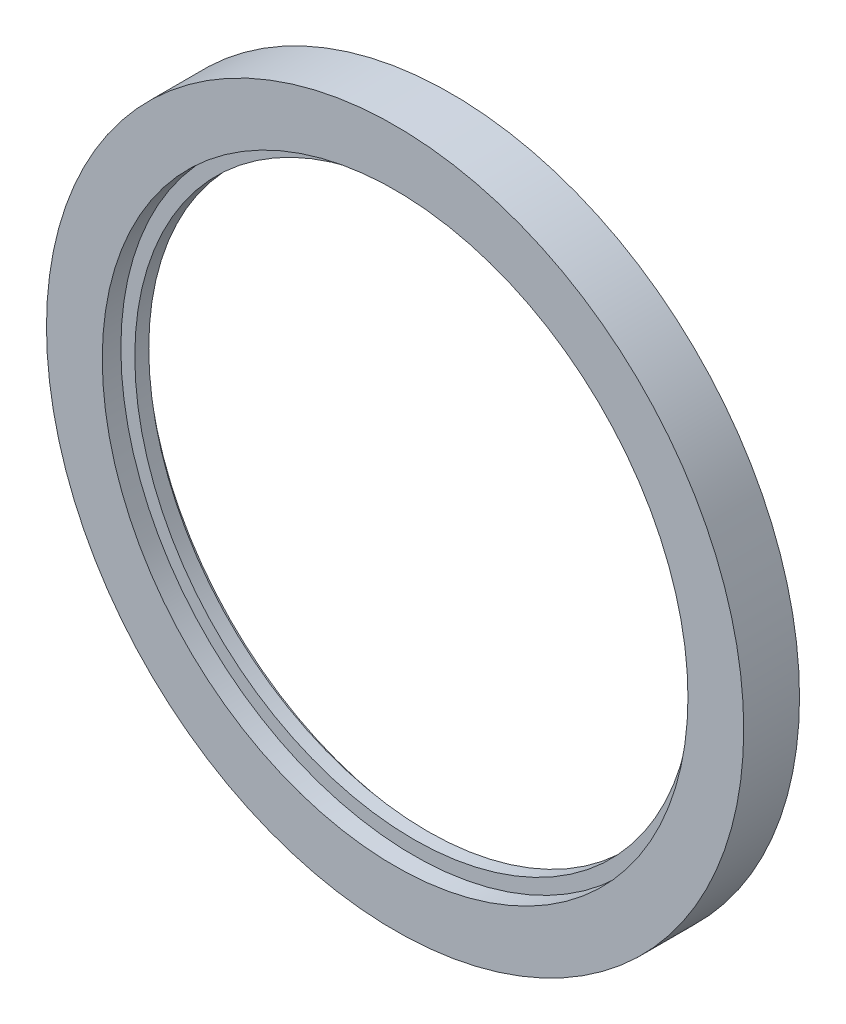
from build123d import *

# Parameters (mm, degrees)
SKETCH_1_R           = 75
SKETCH_1_R_2         = 67.5
F_01_CASE_D135_DEPTH = 3.3
SKETCH_2_R           = 75
SKETCH_2_R_2         = 62
F_02_LIP_CONE_DEPTH  = 1.7
SKETCH_3_R           = 75
SKETCH_3_R_2         = 60
F_03_LIP_D120_DEPTH  = 3
SKETCH_4_R           = 75
SKETCH_4_R_2         = 63
F_04_DUST_LIP_DEPTH  = 4


with BuildPart() as part:
    # 草图1 → 01_CASE_D135 (new body)
    with BuildSketch(Plane.XY):
        Circle(SKETCH_1_R)
        Circle(SKETCH_1_R_2, mode=Mode.SUBTRACT)
    extrude(amount=F_01_CASE_D135_DEPTH)

    # 草图2 → 02_LIP_CONE (add)
    with BuildSketch(Plane.XY.offset(3.3)):
        Circle(SKETCH_2_R)
        Circle(SKETCH_2_R_2, mode=Mode.SUBTRACT)
    extrude(amount=F_02_LIP_CONE_DEPTH)

    # 草图3 → 03_LIP_D120 (add)
    with BuildSketch(Plane.XY.offset(5)):
        Circle(SKETCH_3_R)
        Circle(SKETCH_3_R_2, mode=Mode.SUBTRACT)
    extrude(amount=F_03_LIP_D120_DEPTH)

    # 草图4 → 04_DUST_LIP (add)
    with BuildSketch(Plane.XY.offset(8)):
        Circle(SKETCH_4_R)
        Circle(SKETCH_4_R_2, mode=Mode.SUBTRACT)
    extrude(amount=F_04_DUST_LIP_DEPTH)


solid = part.part
